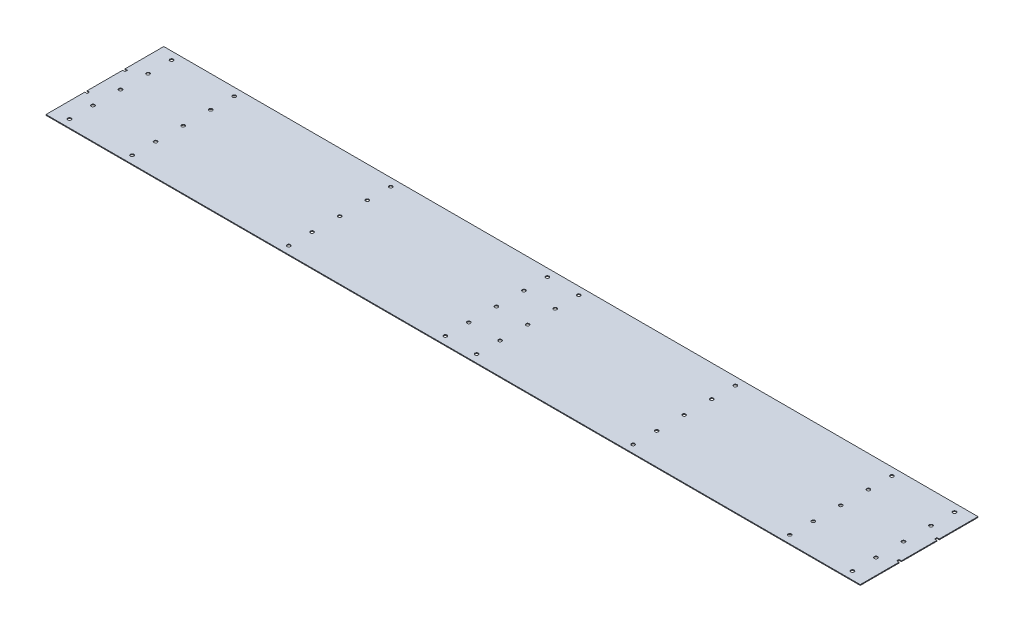
from build123d import *

# Parameters (mm, degrees)
SKETCH1_R           = 2.15
BOSS_EXTRUDE1_DEPTH = 1


with BuildPart() as part:
    # Sketch1 → Boss-Extrude1 (new body)
    with BuildSketch(Plane(origin=(0, 0, 0), x_dir=(1, 0, 0), z_dir=(0, 1, 0))):
        Polygon((-500, -25.7), (-500, -75.2), (540, -75.2), (540, -25.7), (537, -25.7), (537, -22.7), (540, -22.7), (540, 22.7), (537, 22.7), (537, 25.7), (540, 25.7), (540, 75.2), (-500, 75.2), (-500, 25.7), (-497, 25.7), (-497, 22.7), (-500, 22.7), (-500, -22.7), (-497, -22.7), (-497, -25.7), align=None)
        with Locations(Location((0, -35.2, 0), (0, 0, 270))):
            Circle(SKETCH1_R, mode=Mode.SUBTRACT)
        with Locations(Location((0, 35.2, 0), (0, 0, 270))):
            Circle(SKETCH1_R, mode=Mode.SUBTRACT)
        with Locations(Location((0, -65.2, 0), (0, 0, 270))):
            Circle(SKETCH1_R, mode=Mode.SUBTRACT)
        with Locations(Location((0, 65.2, 0), (0, 0, 270))):
            Circle(SKETCH1_R, mode=Mode.SUBTRACT)
        with Locations(Location((-200, -65.2, 0), (0, 0, 270))):
            Circle(SKETCH1_R, mode=Mode.SUBTRACT)
        with Locations(Location((-200, -35.2, 0), (0, 0, 270))):
            Circle(SKETCH1_R, mode=Mode.SUBTRACT)
        with Locations(Location((-200, 35.2, 0), (0, 0, 270))):
            Circle(SKETCH1_R, mode=Mode.SUBTRACT)
        with Locations(Location((-200, 65.2, 0), (0, 0, 270))):
            Circle(SKETCH1_R, mode=Mode.SUBTRACT)
        with Locations(Location((0, 0, 0), (0, 0, 270))):
            Circle(SKETCH1_R, mode=Mode.SUBTRACT)
        with Locations(Location((-200, 0, 0), (0, 0, 270))):
            Circle(SKETCH1_R, mode=Mode.SUBTRACT)
        with Locations(Location((-400, 0, 0), (0, 0, 270))):
            Circle(SKETCH1_R, mode=Mode.SUBTRACT)
        with Locations(Location((-400, -65.2, 0), (0, 0, 270))):
            Circle(SKETCH1_R, mode=Mode.SUBTRACT)
        with Locations(Location((-400, -35.2, 0), (0, 0, 270))):
            Circle(SKETCH1_R, mode=Mode.SUBTRACT)
        with Locations(Location((-400, 35.2, 0), (0, 0, 270))):
            Circle(SKETCH1_R, mode=Mode.SUBTRACT)
        with Locations(Location((-400, 65.2, 0), (0, 0, 270))):
            Circle(SKETCH1_R, mode=Mode.SUBTRACT)
        with Locations(Location((40, -65.2, 0), (0, 0, 270))):
            Circle(SKETCH1_R, mode=Mode.SUBTRACT)
        with Locations(Location((40, -35.2, 0), (0, 0, 270))):
            Circle(SKETCH1_R, mode=Mode.SUBTRACT)
        with Locations(Location((40, 0, 0), (0, 0, 270))):
            Circle(SKETCH1_R, mode=Mode.SUBTRACT)
        with Locations(Location((40, 35.2, 0), (0, 0, 270))):
            Circle(SKETCH1_R, mode=Mode.SUBTRACT)
        with Locations(Location((40, 65.2, 0), (0, 0, 270))):
            Circle(SKETCH1_R, mode=Mode.SUBTRACT)
        with Locations(Location((520, 65.2, 0), (0, 0, 270))):
            Circle(SKETCH1_R, mode=Mode.SUBTRACT)
        with Locations(Location((520, 35.2, 0), (0, 0, 270))):
            Circle(SKETCH1_R, mode=Mode.SUBTRACT)
        with Locations(Location((520, 0, 0), (0, 0, 270))):
            Circle(SKETCH1_R, mode=Mode.SUBTRACT)
        with Locations(Location((520, -35.2, 0), (0, 0, 270))):
            Circle(SKETCH1_R, mode=Mode.SUBTRACT)
        with Locations(Location((520, -65.2, 0), (0, 0, 270))):
            Circle(SKETCH1_R, mode=Mode.SUBTRACT)
        with Locations(Location((240, -65.2, 0), (0, 0, 270))):
            Circle(SKETCH1_R, mode=Mode.SUBTRACT)
        with Locations(Location((240, -35.2, 0), (0, 0, 270))):
            Circle(SKETCH1_R, mode=Mode.SUBTRACT)
        with Locations(Location((240, 0, 0), (0, 0, 270))):
            Circle(SKETCH1_R, mode=Mode.SUBTRACT)
        with Locations(Location((240, 35.2, 0), (0, 0, 270))):
            Circle(SKETCH1_R, mode=Mode.SUBTRACT)
        with Locations(Location((240, 65.2, 0), (0, 0, 270))):
            Circle(SKETCH1_R, mode=Mode.SUBTRACT)
        with Locations(Location((440, -65.2, 0), (0, 0, 270))):
            Circle(SKETCH1_R, mode=Mode.SUBTRACT)
        with Locations(Location((440, -35.2, 0), (0, 0, 270))):
            Circle(SKETCH1_R, mode=Mode.SUBTRACT)
        with Locations(Location((440, 0, 0), (0, 0, 270))):
            Circle(SKETCH1_R, mode=Mode.SUBTRACT)
        with Locations(Location((440, 35.2, 0), (0, 0, 270))):
            Circle(SKETCH1_R, mode=Mode.SUBTRACT)
        with Locations(Location((440, 65.2, 0), (0, 0, 270))):
            Circle(SKETCH1_R, mode=Mode.SUBTRACT)
        with Locations(Location((-480, 65.2, 0), (0, 0, 270))):
            Circle(SKETCH1_R, mode=Mode.SUBTRACT)
        with Locations(Location((-480, 35.2, 0), (0, 0, 270))):
            Circle(SKETCH1_R, mode=Mode.SUBTRACT)
        with Locations(Location((-480, 0, 0), (0, 0, 270))):
            Circle(SKETCH1_R, mode=Mode.SUBTRACT)
        with Locations(Location((-480, -65.2, 0), (0, 0, 270))):
            Circle(SKETCH1_R, mode=Mode.SUBTRACT)
        with Locations(Location((-480, -35.2, 0), (0, 0, 270))):
            Circle(SKETCH1_R, mode=Mode.SUBTRACT)
    extrude(amount=BOSS_EXTRUDE1_DEPTH)


solid = part.part
